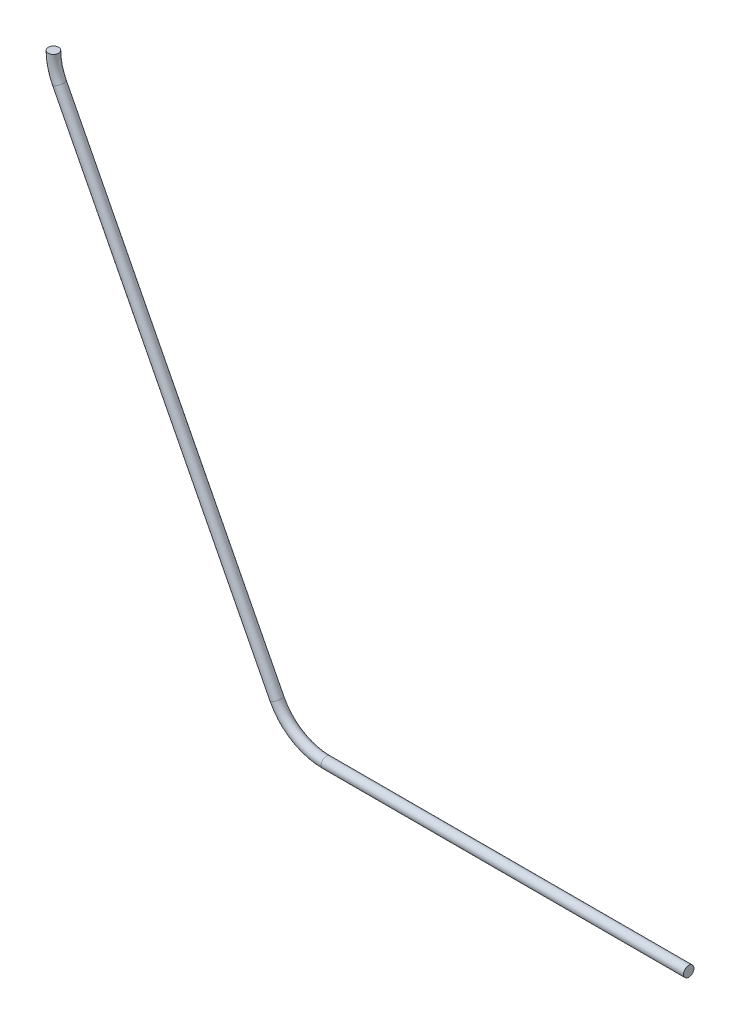
from build123d import *

# Parameters (mm, degrees)
SKETCH6_R = 0.5


with BuildPart() as part:
    # Sweep1: sweep along a path in Sketch1
    with BuildLine(Plane.XY) as sweep1_path:
        Line((56, -46.36), (21, -46.36))
        ThreePointArc((21, -46.36), (18.204247095, -45.573113348), (16.229367564, -43.443494662))
        Line((16.229367564, -43.443494662), (-4.770632436, -2.443494662))
        ThreePointArc((-4.770632436, -2.443494662), (-5.210575297, -1.256783622), (-5.36, 0))
    # Sketch6 → Sweep1 (sweep)
    with BuildSketch(Plane(origin=(0, 0, 0), x_dir=(1, 0, 0), z_dir=(0, 1, 0))):
        with Locations((-5.36, 0)):
            Circle(SKETCH6_R)
    sweep(path=sweep1_path.line)


solid = part.part
